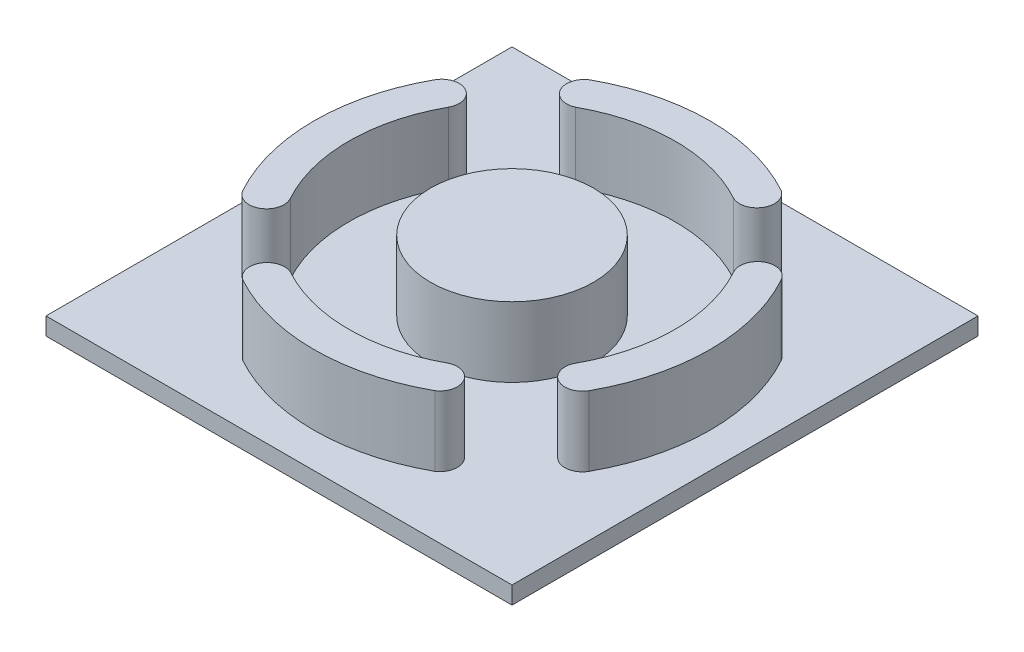
from build123d import *

# Parameters (mm, degrees)
SKETCH1_W           = 40
SKETCH1_H           = 40
BOSS_EXTRUDE1_DEPTH = 1.5
SKETCH2_R           = 7
BOSS_EXTRUDE2_DEPTH = 6


with BuildPart() as part:
    # Sketch1 → Boss-Extrude1 (new body)
    with BuildSketch(Plane(origin=(0, 0, 0), x_dir=(1, 0, 0), z_dir=(0, 1, 0))):
        with Locations((0, 20)):
            Rectangle(SKETCH1_W, SKETCH1_H)
    extrude(amount=BOSS_EXTRUDE1_DEPTH)

    # Sketch2 → Boss-Extrude2 (add)
    with BuildSketch(Plane(origin=(0, 1.5, 0), x_dir=(1, 0, 0), z_dir=(0, 1, 0))):
        with Locations(Location((0, 20, 0), (0, 0, 270))):
            Circle(SKETCH2_R)
        with BuildLine():
            ThreePointArc((-6.787334683, 32.2446759), (0, 34), (6.787334683, 32.2446759))
            ThreePointArc((6.787334683, 32.2446759), (8.731496224, 32.882040662), (8.241763544, 34.868535021))
            ThreePointArc((8.241763544, 34.868535021), (0, 37), (-8.241763544, 34.868535021))
            ThreePointArc((-8.241763544, 34.868535021), (-8.731496224, 32.882040662), (-6.787334683, 32.2446759))
        make_face()
        with BuildLine():
            ThreePointArc((-8.241763544, 5.131464979), (0, 3), (8.241763544, 5.131464979))
            ThreePointArc((8.241763544, 5.131464979), (8.731496224, 7.117959338), (6.787334683, 7.7553241))
            ThreePointArc((6.787334683, 7.7553241), (0, 6), (-6.787334683, 7.7553241))
            ThreePointArc((-6.787334683, 7.7553241), (-8.731496224, 7.117959338), (-8.241763544, 5.131464979))
        make_face()
        with BuildLine():
            ThreePointArc((12.2446759, 26.787334683), (14, 20), (12.2446759, 13.212665317))
            ThreePointArc((12.2446759, 13.212665317), (12.82939103, 11.173521325), (14.868535021, 11.758236456))
            ThreePointArc((14.868535021, 11.758236456), (17, 20), (14.868535021, 28.241763544))
            ThreePointArc((14.868535021, 28.241763544), (12.82939103, 28.826478675), (12.2446759, 26.787334683))
        make_face()
        with BuildLine():
            ThreePointArc((-12.2446759, 26.787334683), (-14, 20), (-12.2446759, 13.212665317))
            ThreePointArc((-12.2446759, 13.212665317), (-12.82939103, 11.173521325), (-14.868535021, 11.758236456))
            ThreePointArc((-14.868535021, 11.758236456), (-17, 20), (-14.868535021, 28.241763544))
            ThreePointArc((-14.868535021, 28.241763544), (-12.82939103, 28.826478675), (-12.2446759, 26.787334683))
        make_face()
    extrude(amount=BOSS_EXTRUDE2_DEPTH)


solid = part.part
